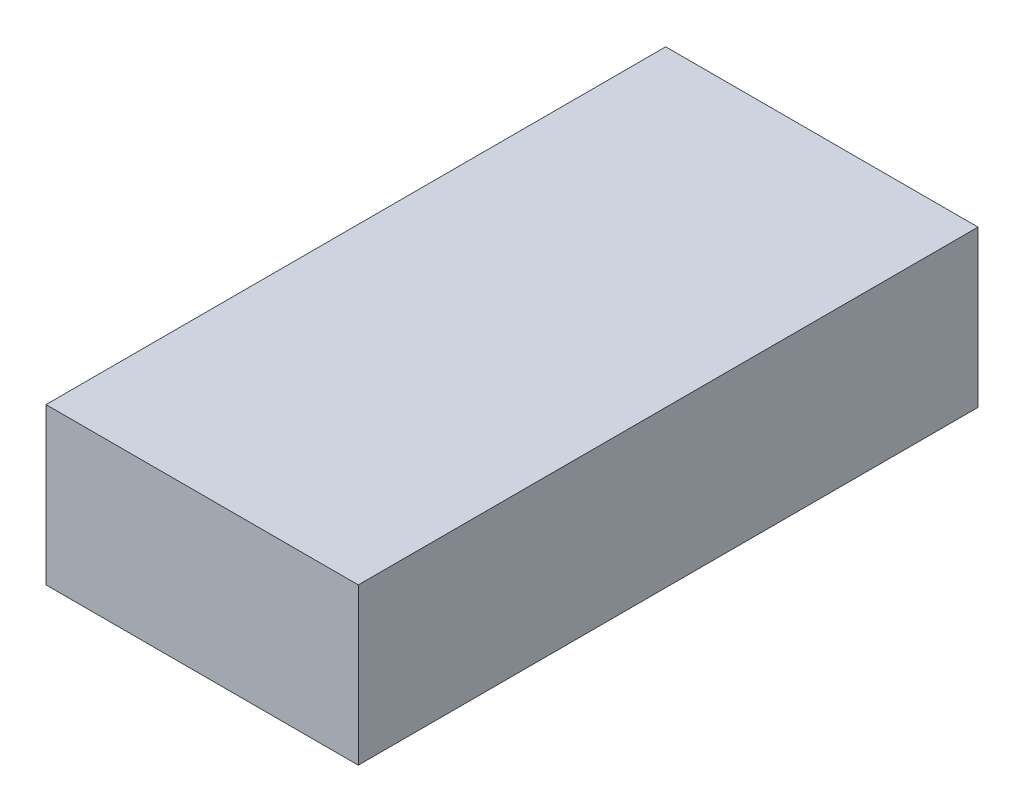
from build123d import *

# Parameters (mm, degrees)
BOSS_EXTRUDE1_DEPTH      = 39.6875
BOSS_EXTRUDE1_DEPTH_BACK = 39.6875
SKETCH1_W                = 40
SKETCH1_H                = 20


with BuildPart() as part:
    # Sketch1 → Boss-Extrude1 (new, two sides: drawn at the far end of the back side and taken through both)
    with BuildSketch(Plane.XY.offset(-BOSS_EXTRUDE1_DEPTH_BACK)):
        Rectangle(SKETCH1_W, SKETCH1_H)
    extrude(amount=BOSS_EXTRUDE1_DEPTH + BOSS_EXTRUDE1_DEPTH_BACK)


solid = part.part
